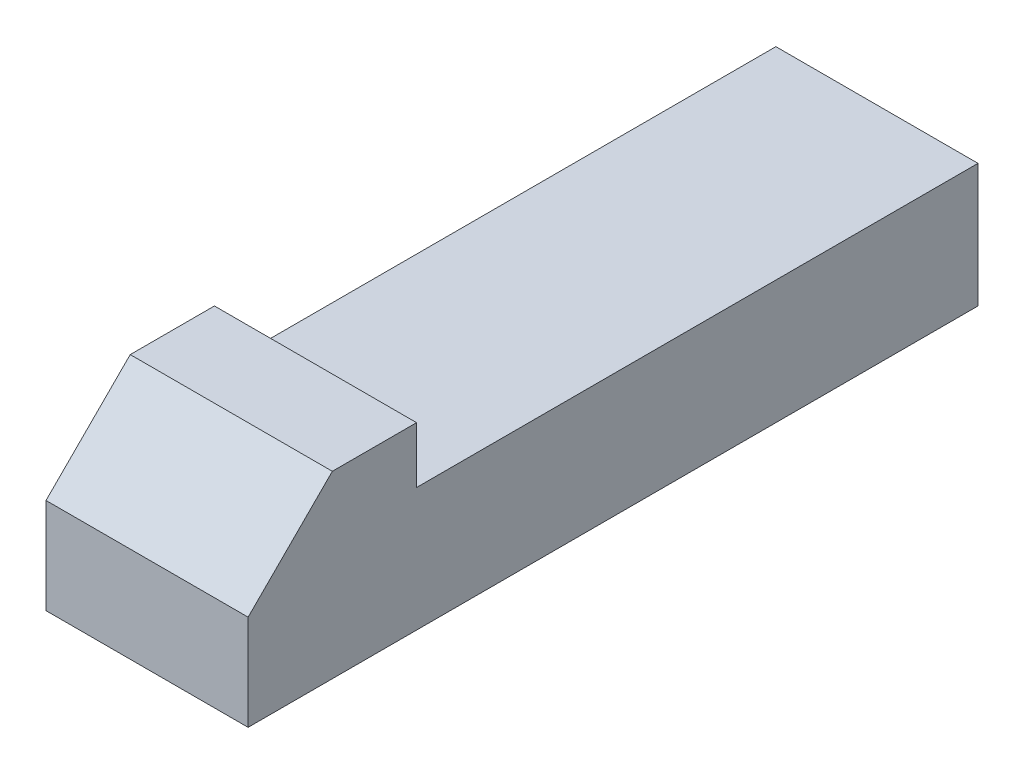
from build123d import *

# Parameters (mm, degrees)
SKETCH1_W           = 18
SKETCH1_H           = 11
BOSS_EXTRUDE1_DEPTH = 65
SKETCH2_W           = 18
SKETCH2_H           = 15
BOSS_EXTRUDE2_DEPTH = 5
CUT_EXTRUDE1_DEPTH  = 69.258699079


with BuildPart() as part:
    # Sketch1 → Boss-Extrude1 (new body)
    with BuildSketch(Plane.XY):
        Rectangle(SKETCH1_W, SKETCH1_H)
    extrude(amount=-BOSS_EXTRUDE1_DEPTH)

    # Sketch2 → Boss-Extrude2 (add)
    with BuildSketch(Plane(origin=(0, 5.5, 0), x_dir=(1, 0, 0), z_dir=(0, 1, 0))):
        with Locations((0, 7.5)):
            Rectangle(SKETCH2_W, SKETCH2_H)
    extrude(amount=BOSS_EXTRUDE2_DEPTH)

    # Sketch3 → Cut-Extrude1 (cut, through all)
    with BuildSketch(Plane(origin=(9, 0, 0), x_dir=(0, 0, -1), z_dir=(1, 0, 0))):
        Polygon((7.5, 10.5), (0, 3), (0, 10.5), align=None)
    extrude(amount=-CUT_EXTRUDE1_DEPTH, mode=Mode.SUBTRACT)


solid = part.part
